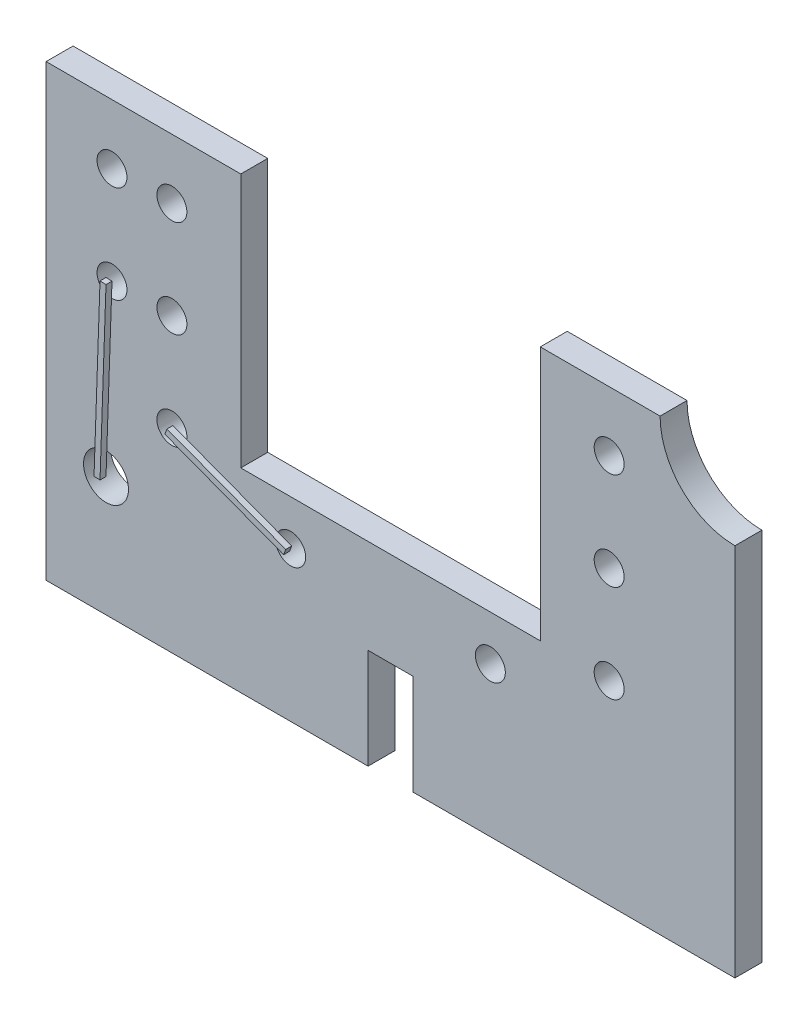
from build123d import *

# Parameters (mm, degrees)
EXTRUDE_1_DEPTH     = 0.45
CUT_EXTRUDE_1_DEPTH = 5
SKETCH_6_R          = 0.5
SKETCH_6_R_2        = 0.75
CUT_EXTRUDE_4_DEPTH = 10.1
EXTRUDE_1_2_DEPTH   = 0.2
SKETCH_8_W          = 0.2
SKETCH_8_H          = 3.25
EXTRUDE_2_DEPTH     = 0.2
EXTRUDE_3_DEPTH     = 0.2


with BuildPart() as part:
    # Эскиз1 → Extrude 1 (new, symmetric)
    with BuildSketch(Plane.XY):
        with BuildLine():
            Line((-11.5, -18.5), (11.5, -18.5))
            Line((11.5, -18.5), (11.5, -6))
            ThreePointArc((11.5, -6), (9.732233047, -5.267766953), (9, -3.5))
            Line((9, -3.5), (5, -3.5))
            Line((5, -3.5), (5, -12))
            Line((5, -12), (-5, -12))
            Line((-5, -12), (-5, -3.5))
            Line((-5, -3.5), (-9, -3.5))
            Line((-9, -3.5), (-11.5, -3.5))
            Line((-11.5, -3.5), (-11.5, -6))
            Line((-11.5, -6), (-11.5, -18.5))
        make_face()
    extrude(amount=EXTRUDE_1_DEPTH, both=True)

    # Эскиз2 → Вырез-Вытянуть1 (cut, symmetric)
    with BuildSketch(Plane.XY):
        Polygon((-0.75, -15.25), (-0.75, -18.5), (0.75, -18.5), (0.75, -15.25), (0.75, -15.15), (-0.75, -15.15), align=None)
    extrude(amount=CUT_EXTRUDE_1_DEPTH, both=True, mode=Mode.SUBTRACT)

    # Эскиз6 → Вырез-Вытянуть4 (cut, symmetric)
    with BuildSketch(Plane.XY):
        with Locations((3.333333333, -13.5)):
            Circle(SKETCH_6_R)
        with Locations((-7.3, -8.75)):
            Circle(SKETCH_6_R)
        with Locations((-7.3, -5.5)):
            Circle(SKETCH_6_R)
        with Locations((7.3, -8.75)):
            Circle(SKETCH_6_R)
        with Locations((7.3, -5.5)):
            Circle(SKETCH_6_R)
        with Locations((-3.333333333, -13.5)):
            Circle(SKETCH_6_R)
        with Locations((-7.3, -12)):
            Circle(SKETCH_6_R)
        with Locations((7.3, -12)):
            Circle(SKETCH_6_R)
        with Locations((-9.5, -14.5)):
            Circle(SKETCH_6_R_2)
        with Locations((-9.3, -8.75)):
            Circle(SKETCH_6_R)
        with Locations((-9.3, -5.5)):
            Circle(SKETCH_6_R)
    extrude(amount=CUT_EXTRUDE_4_DEPTH, both=True, mode=Mode.SUBTRACT)

    # Эскиз7 → Extrude 1 2 (add)
    with BuildSketch(Plane.XY.offset(0.45)):
        Polygon((-7.335370626, -12.093535655), (-3.368703959, -13.593535655), (-3.297962707, -13.406464345), (-7.264629374, -11.906464345), align=None)
    extrude(amount=EXTRUDE_1_2_DEPTH)

    # Эскиз8 → Вытянуть-Тонкостенный2 (add)
    with BuildSketch(Plane(origin=(0, 0, -0.45), x_dir=(-1, 0, 0), z_dir=(0, 0, -1))):
        with Locations((9.4, -7.125)):
            Rectangle(SKETCH_8_W, SKETCH_8_H)
    extrude(amount=EXTRUDE_2_DEPTH)

    # Эскиз9 → Вытянуть-Тонкостенный3 (add)
    with BuildSketch(Plane.XY.offset(0.45)):
        Polygon((-9.3, -8.75), (-9.5, -14.5), (-9.699879127, -14.493047683), (-9.499879127, -8.743047683), align=None)
    extrude(amount=EXTRUDE_3_DEPTH)


solid = part.part
